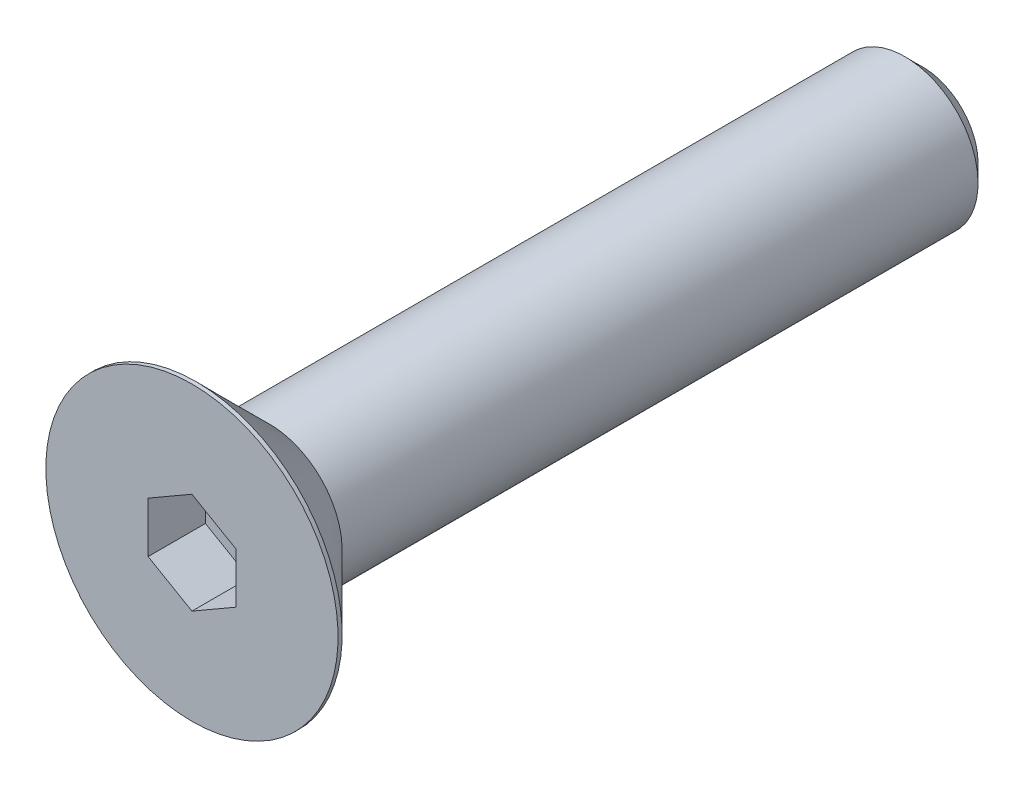
from build123d import *

# Parameters (mm, degrees)
CHAMFER1_SIZE      = 0.6
CUT_EXTRUDE2_DEPTH = 1.96


with BuildPart() as part:
    # Sketch1 → Revolve1 (revolve)
    with BuildSketch(Plane(origin=(0, 0, 0), x_dir=(0, 0, -1), z_dir=(1, 0, 0))):
        Polygon((-9.7, 2.5), (12.5, 2.5), (12.5, 0), (-10.54, 0), (-10.54, 2.5), align=None)
    revolve(axis=Axis((0, 0, 10.54), (0, 0, -1)))

    # Chamfer1
    chamfer1_edges = [part.edges().sort_by_distance(p)[0] for p in [
        (0, -2.5, -12.5),
    ]]
    chamfer(chamfer1_edges, length=CHAMFER1_SIZE)


with BuildPart() as body_2:
    # Sketch7 → Revolve2 (revolve)
    with BuildSketch(Plane(origin=(0, 0, 0), x_dir=(0, 0, -1), z_dir=(1, 0, 0))):
        Polygon((-12.36, 5), (-12.5, 5), (-12.5, 0), (-9.7, 0), (-9.7, 2.34), align=None)
    revolve(axis=Axis((0, 0, 12.5), (0, 0, -1)))

    # Sketch5 → Cut-Extrude2 (cut)
    with BuildSketch(Plane.XY.offset(12.5)):
        Polygon((1.5, -0.866025404), (1.5, 0.866025404), (0, 1.732050808), (-1.5, 0.866025404), (-1.5, -0.866025404), (0, -1.732050808), align=None)
    extrude(amount=-CUT_EXTRUDE2_DEPTH, mode=Mode.SUBTRACT)


solid = Compound([part.part, body_2.part])
